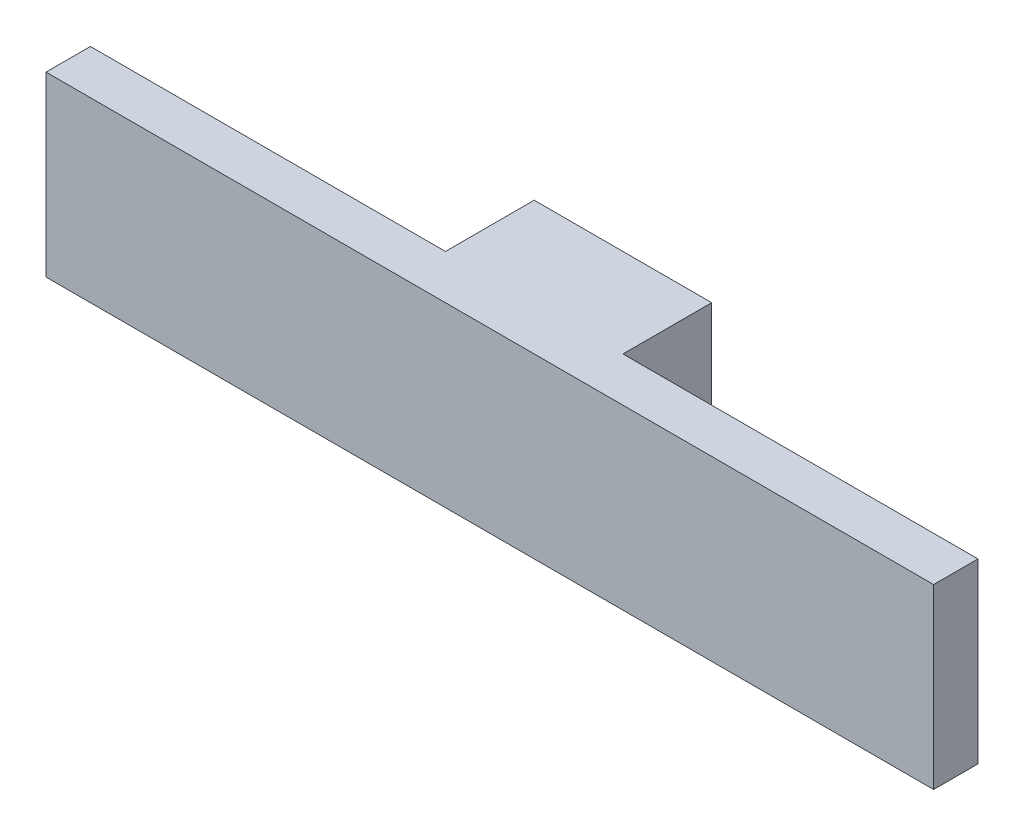
from build123d import *

# Parameters (mm, degrees)
BOSS_EXTRUDE1_DEPTH = 20


with BuildPart() as part:
    # Sketch2 → Boss-Extrude1 (new body)
    with BuildSketch(Plane(origin=(0, 0, 0), x_dir=(1, 0, 0), z_dir=(0, 1, 0))):
        Polygon((50, -15), (-50, -15), (-50, -10), (-10, -10), (-10, 0), (10, 0), (10, -10), (50, -10), align=None)
    extrude(amount=BOSS_EXTRUDE1_DEPTH)


solid = part.part
